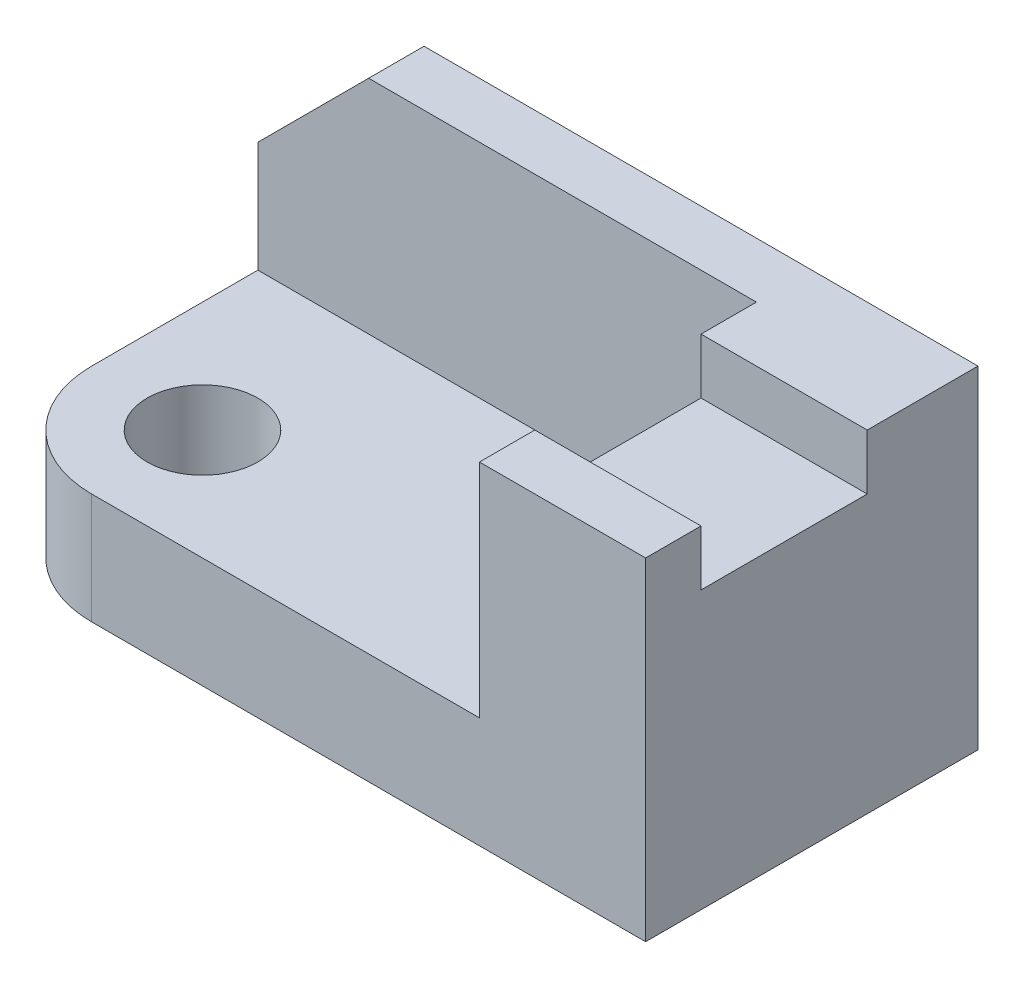
from build123d import *

# Parameters (mm, degrees)
SKETCH1_W           = 120
SKETCH1_H           = 60
BOSS_EXTRUDE1_DEPTH = 20
BOSS_EXTRUDE4_DEPTH = 40
FILLET2_R           = 20
CHAMFER1_SIZE       = 20
SKETCH5_W           = 30
SKETCH5_H           = 30
CUT_EXTRUDE1_DEPTH  = 10
SKETCH6_R           = 10
CUT_EXTRUDE2_DEPTH  = 141


with BuildPart() as part:
    # Sketch1 → Boss-Extrude1 (new body)
    with BuildSketch(Plane(origin=(0, 0, 0), x_dir=(1, 0, 0), z_dir=(0, 1, 0))):
        with Locations((-60, 30)):
            Rectangle(SKETCH1_W, SKETCH1_H)
    extrude(amount=BOSS_EXTRUDE1_DEPTH)

    # Sketch2 → Boss-Extrude4 (add)
    with BuildSketch(Plane(origin=(0, 20, 0), x_dir=(1, 0, 0), z_dir=(0, 1, 0))):
        Polygon((0, 60), (-30, 60), (-120, 60), (-120, 50), (-30, 50), (-30, 0), (0, 0), align=None)
    extrude(amount=BOSS_EXTRUDE4_DEPTH)

    # Fillet2
    fillet2_edges = [part.edges().sort_by_distance(p)[0] for p in [
        (-120, 10, 0),
    ]]
    fillet(fillet2_edges, radius=FILLET2_R)

    # Chamfer1
    chamfer1_edges = [part.edges().sort_by_distance(p)[0] for p in [
        (-120, 60, -55),
    ]]
    chamfer(chamfer1_edges, length=CHAMFER1_SIZE)

    # Sketch5 → Cut-Extrude1 (cut)
    with BuildSketch(Plane(origin=(0, 60, 0), x_dir=(1, 0, 0), z_dir=(0, 1, 0))):
        with Locations((-15, 25)):
            Rectangle(SKETCH5_W, SKETCH5_H)
    extrude(amount=-CUT_EXTRUDE1_DEPTH, mode=Mode.SUBTRACT)

    # Sketch6 → Cut-Extrude2 (cut, through all)
    with BuildSketch(Plane(origin=(0, 20, 0), x_dir=(1, 0, 0), z_dir=(0, 1, 0))):
        with Locations(Location((-100, 20, 0), (0, 0, 270))):
            Circle(SKETCH6_R)
    extrude(amount=-CUT_EXTRUDE2_DEPTH, mode=Mode.SUBTRACT)


solid = part.part
